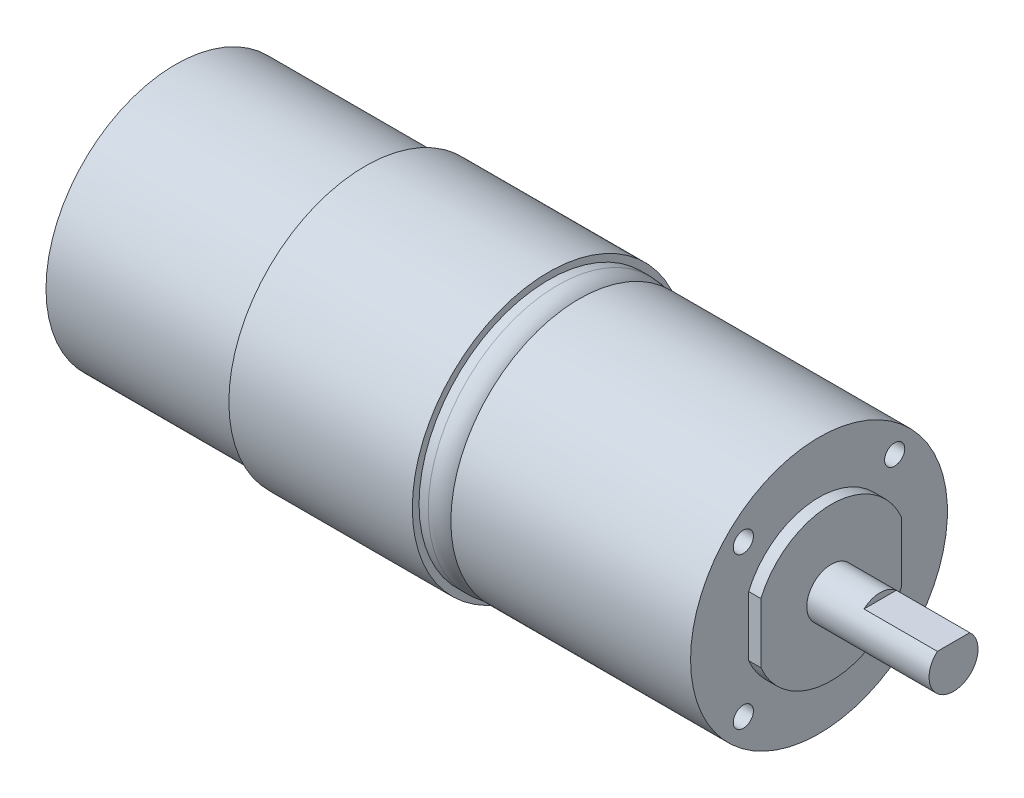
from build123d import *

# Parameters (mm, degrees)
SKETCH1_R                = 12.5
BOSS_EXTRUDE1_DEPTH      = 2
SKETCH3_R                = 21
BOSS_EXTRUDE2_DEPTH      = 39.2
SKETCH5_R                = 21.2
BOSS_EXTRUDE3_DEPTH      = 66
FILLET1_R                = 3.5
BOSS_EXTRUDE4_START      = 5
SKETCH4_R                = 22.3
BOSS_EXTRUDE4_DEPTH      = 30
SKETCH6_R                = 4
BOSS_EXTRUDE5_DEPTH      = 20
SKETCH7_W                = 5.291502622
SKETCH7_H                = 2
CUT_EXTRUDE1_DEPTH       = 12
M4X0_7_M4X6DP_AT_2_COUNT = 2
M4X0_7_M4X6DP_AT_2_PITCH = 24.748737342
M4X0_7_M4X6DP_AT_3_COUNT = 2
M4X0_7_M4X6DP_AT_3_PITCH = 35
M4X0_7_M4X6DP_AT_4_COUNT = 2
M4X0_7_M4X6DP_AT_4_PITCH = 24.748737342
SKETCH11_OUTSIDE_W       = 74.996
SKETCH11_OUTSIDE_H       = 74.996
SKETCH11_OUTSIDE_W_2     = 23
SKETCH11_OUTSIDE_H_2     = 25
CUT_EXTRUDE2_DEPTH       = 2


with BuildPart() as part:
    # Sketch1 → Boss-Extrude1 (new body)
    with BuildSketch(Plane(origin=(0, 0, 0), x_dir=(0, 0, -1), z_dir=(1, 0, 0))):
        Circle(SKETCH1_R)
    extrude(amount=-BOSS_EXTRUDE1_DEPTH)

    # Sketch3 → Boss-Extrude2 (add)
    with BuildSketch(Plane.ZY.offset(2)):
        Circle(SKETCH3_R)
    extrude(amount=BOSS_EXTRUDE2_DEPTH)

    # Sketch6 → Boss-Extrude5 (add)
    with BuildSketch(Plane(origin=(0, 0, 0), x_dir=(0, 0, -1), z_dir=(1, 0, 0))):
        Circle(SKETCH6_R)
    extrude(amount=BOSS_EXTRUDE5_DEPTH)

    # Sketch7 → Cut-Extrude1 (cut)
    with BuildSketch(Plane(origin=(20, 0, 0), x_dir=(0, 0, -1), z_dir=(1, 0, 0))):
        with Locations((0, 4)):
            Rectangle(SKETCH7_W, SKETCH7_H)
    extrude(amount=-CUT_EXTRUDE1_DEPTH, mode=Mode.SUBTRACT)

    # Sketch10 → M4x0.7 "M4x6DP" (revolve, cut)
    with BuildSketch(Plane(origin=(-2, 12.374368671, 12.374368671), x_dir=(0, 0, -1), z_dir=(0, 1, 0))):
        Polygon((0, 0), (0, 11.091420021), (1.65, 10.1), (1.65, 0), align=None)
    m4x0_7_m4x6dp = revolve(axis=Axis((4.35, 12.374368671, 12.374368671), (-1, 0, 0)), mode=Mode.SUBTRACT)

    # M4x0.7 "M4x6DP" at 2: M4x0.7 "M4x6DP" ×2
    with Locations(*[(0, 0, -i * M4X0_7_M4X6DP_AT_2_PITCH) for i in range(1, M4X0_7_M4X6DP_AT_2_COUNT)]):
        add(m4x0_7_m4x6dp, mode=Mode.SUBTRACT)

    # M4x0.7 "M4x6DP" at 3: M4x0.7 "M4x6DP" ×2
    with Locations(*[Vector(0, -0.7071067811865476, -0.7071067811865476) * (i * M4X0_7_M4X6DP_AT_3_PITCH) for i in range(1, M4X0_7_M4X6DP_AT_3_COUNT)]):
        add(m4x0_7_m4x6dp, mode=Mode.SUBTRACT)

    # M4x0.7 "M4x6DP" at 4: M4x0.7 "M4x6DP" ×2
    with Locations(*[(0, -i * M4X0_7_M4X6DP_AT_4_PITCH, 0) for i in range(1, M4X0_7_M4X6DP_AT_4_COUNT)]):
        add(m4x0_7_m4x6dp, mode=Mode.SUBTRACT)

    # Sketch11 outside → Cut-Extrude2 (cut)
    with BuildSketch(Plane(origin=(0, 0, 0), x_dir=(0, 0, -1), z_dir=(1, 0, 0))):
        Rectangle(SKETCH11_OUTSIDE_W, SKETCH11_OUTSIDE_H)
        Rectangle(SKETCH11_OUTSIDE_W_2, SKETCH11_OUTSIDE_H_2, mode=Mode.SUBTRACT)
    extrude(amount=-CUT_EXTRUDE2_DEPTH, mode=Mode.SUBTRACT)


with BuildPart() as body_2:
    # Sketch5 → Boss-Extrude3 (new body)
    with BuildSketch(Plane.ZY.offset(41.2)):
        Circle(SKETCH5_R)
    extrude(amount=BOSS_EXTRUDE3_DEPTH)

    # Fillet1
    fillet1_edges = [body_2.edges().sort_by_distance(p)[0] for p in [
        (-41.2, 0, -21.2),
    ]]
    fillet(fillet1_edges, radius=FILLET1_R)

    # Sketch4 → Boss-Extrude4 (add)
    with BuildSketch(Plane.ZY.offset(41.2).offset(BOSS_EXTRUDE4_START)):
        Circle(SKETCH4_R)
    extrude(amount=BOSS_EXTRUDE4_DEPTH)


solid = Compound([part.part, body_2.part])
